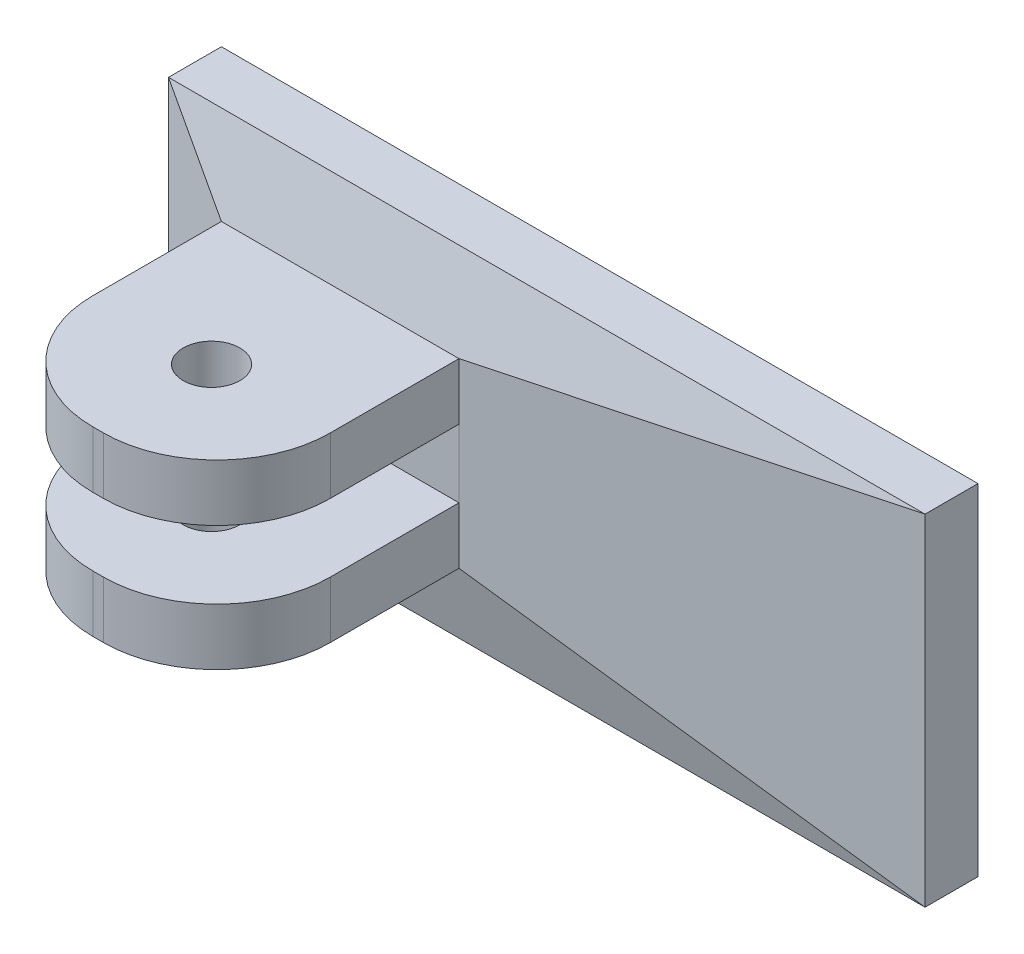
from build123d import *

# Parameters (mm, degrees)
SKETCH1_W           = 100
SKETCH1_H           = 45
BOSS_EXTRUDE1_DEPTH = 10
SKETCH3_W           = 31.4
SKETCH3_H           = 7.5
BOSS_EXTRUDE2_DEPTH = 5
SKETCH4_R           = 3.75
BOSS_EXTRUDE3_DEPTH = 7.5
CUT_EXTRUDE1_DEPTH  = 45
CUT_EXTRUDE2_DEPTH  = 100


with BuildPart() as part:
    # Sketch1 → Boss-Extrude1 (new body)
    with BuildSketch(Plane.XY):
        with Locations((26.050004349, -7.647768163)):
            Rectangle(SKETCH1_W, SKETCH1_H)
    extrude(amount=BOSS_EXTRUDE1_DEPTH)

    # Sketch3 → Boss-Extrude2 (add)
    with BuildSketch(Plane.XY.offset(10)):
        with Locations((1.750004349, 1.102231837)):
            Rectangle(SKETCH3_W, SKETCH3_H)
    boss_extrude2 = extrude(amount=BOSS_EXTRUDE2_DEPTH)

    # Sketch4 → Boss-Extrude3 (add)
    with BuildSketch(Plane.XZ.offset(2.647768163)):
        with BuildLine():
            Line((-13.949995651, 15), (-13.949995651, 27))
            ThreePointArc((-13.949995651, 27), (-9.556597369, 37.606601718), (1.050004349, 42))
            Line((1.050004349, 42), (2.450004349, 42))
            ThreePointArc((2.450004349, 42), (13.056606067, 37.606601718), (17.450004349, 27))
            Line((17.450004349, 27), (17.450004349, 15))
            Line((17.450004349, 15), (-13.949995651, 15))
        make_face()
        with Locations(Location((1.744890168, 27, 0), (0, 0, 270))):
            Circle(SKETCH4_R, mode=Mode.SUBTRACT)
    boss_extrude3 = extrude(amount=-BOSS_EXTRUDE3_DEPTH)

    # Mirror1: Boss-Extrude2, Boss-Extrude3 across plane
    add(boss_extrude2.mirror(Plane(origin=(0, -7.147768163, 0), x_dir=(0, 0, 1), z_dir=(0, -1, 0))))
    add(boss_extrude3.mirror(Plane(origin=(0, -7.147768163, 0), x_dir=(0, 0, 1), z_dir=(0, -1, 0))))

    # Sketch5 → Cut-Extrude1 (cut)
    with BuildSketch(Plane.XZ.offset(30.147768163)):
        Polygon((-13.949995651, 10), (-23.949995651, 7), (-23.949995651, 10), align=None)
        Polygon((17.450004349, 10), (76.050004349, 7), (76.050004349, 10), align=None)
    extrude(amount=-CUT_EXTRUDE1_DEPTH, mode=Mode.SUBTRACT)

    # Sketch6 → Cut-Extrude2 (cut)
    with BuildSketch(Plane.ZY.offset(23.949995651)):
        Polygon((7, 14.852231837), (10, 4.852231837), (10, 14.852231837), align=None)
        Polygon((10, -19.147768163), (7, -30.147768163), (10, -30.147768163), align=None)
    extrude(amount=-CUT_EXTRUDE2_DEPTH, mode=Mode.SUBTRACT)


solid = part.part
